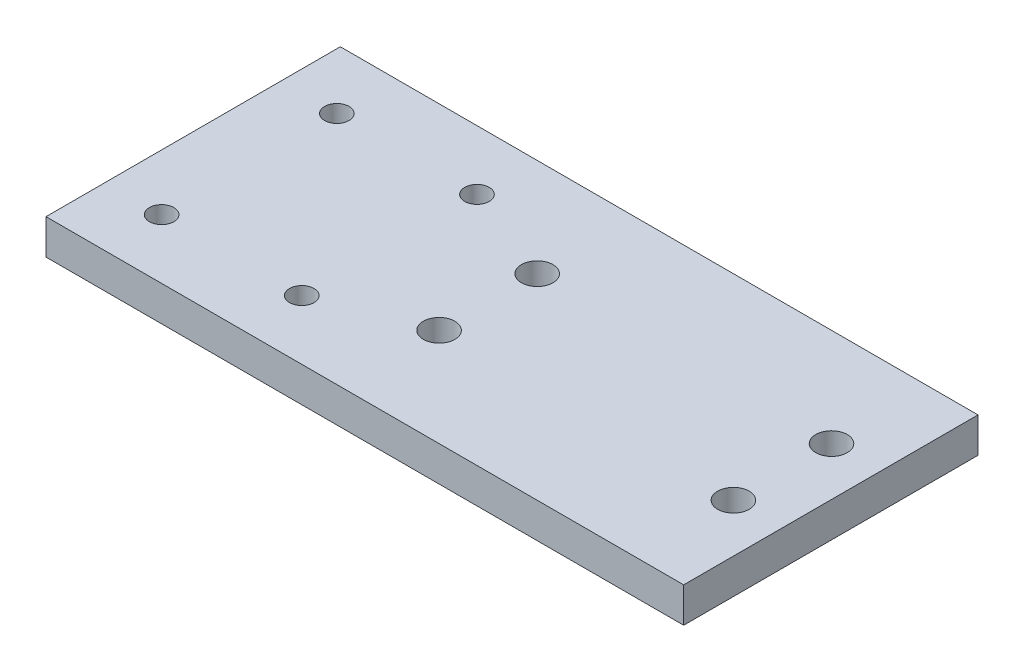
from build123d import *

# Parameters (mm, degrees)
SKETCH_1_W          = 91
SKETCH_1_H          = 42
EXTRUDE_1_DEPTH     = 5
SKETCH_2_R          = 1.75
SKETCH_2_R_2        = 2.25
CUT_EXTRUDE_1_DEPTH = 5


with BuildPart() as part:
    # 스케치1 → 보스-돌출1 (new body)
    with BuildSketch(Plane(origin=(0, 0, 0), x_dir=(1, 0, 0), z_dir=(0, 1, 0))):
        with Locations((45.5, 21)):
            Rectangle(SKETCH_1_W, SKETCH_1_H)
    extrude(amount=EXTRUDE_1_DEPTH)

    # 스케치2 → 컷-돌출1 (cut)
    with BuildSketch(Plane(origin=(0, 5, 0), x_dir=(1, 0, 0), z_dir=(0, 1, 0))):
        with Locations(Location((28, 33.5, 0), (0, 0, 270))):
            Circle(SKETCH_2_R)
        with Locations(Location((28, 8.5, 0), (0, 0, 270))):
            Circle(SKETCH_2_R)
        with Locations(Location((8, 8.5, 0), (0, 0, 270))):
            Circle(SKETCH_2_R)
        with Locations(Location((8, 33.5, 0), (0, 0, 270))):
            Circle(SKETCH_2_R)
        with Locations(Location((42.094873015, 28, 0), (0, 0, 270))):
            Circle(SKETCH_2_R_2)
        with Locations(Location((42.094873015, 14, 0), (0, 0, 270))):
            Circle(SKETCH_2_R_2)
        with Locations(Location((84.094873015, 14, 0), (0, 0, 270))):
            Circle(SKETCH_2_R_2)
        with Locations(Location((84.094873015, 28, 0), (0, 0, 270))):
            Circle(SKETCH_2_R_2)
    extrude(amount=-CUT_EXTRUDE_1_DEPTH, mode=Mode.SUBTRACT)


solid = part.part
